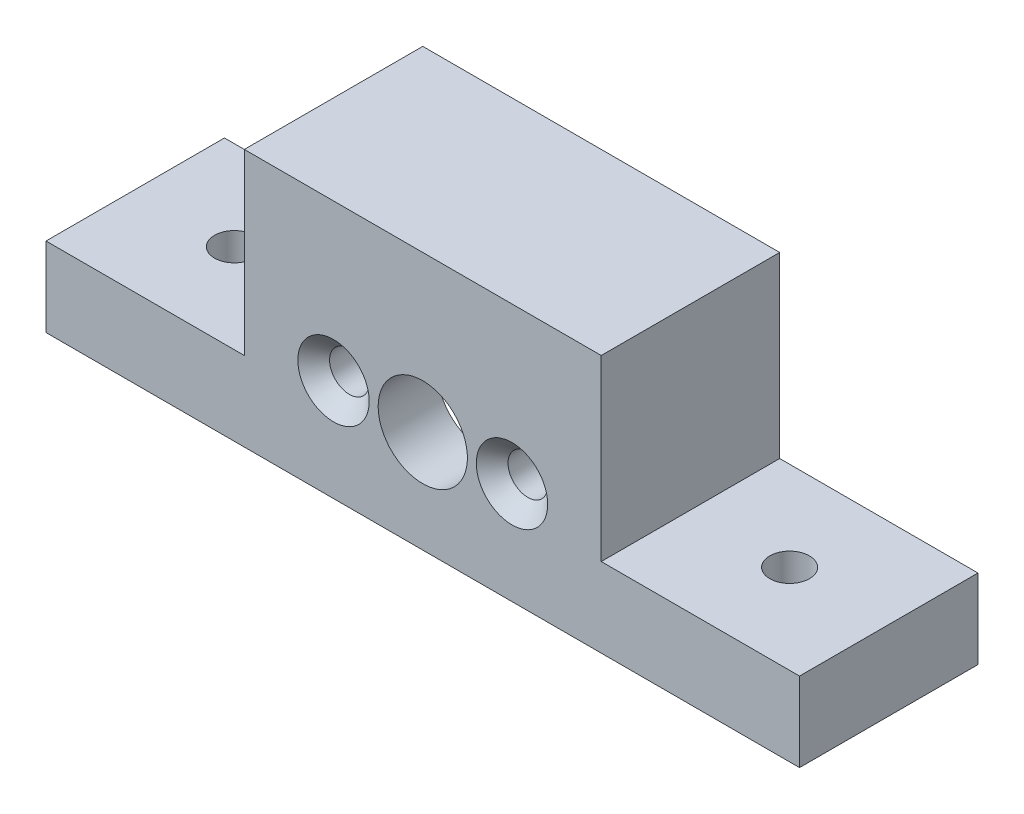
from build123d import *

# Parameters (mm, degrees)
SKETCH3_W                                            = 18
SKETCH3_H                                            = 13
BOSS_EXTRUDE1_DEPTH                                  = 9
SKETCH9_W                                            = 12.6
SKETCH9_H                                            = 10.3
CUT_EXTRUDE2_DEPTH                                   = 6
SKETCH10_R                                           = 2.25
CUT_EXTRUDE3_DEPTH                                   = 13.619429464
CSK_FOR_M1_6_COUNTERSUNK_FLAT_HEAD_SCREW_D           = 2
CSK_FOR_M1_6_COUNTERSUNK_FLAT_HEAD_SCREW_CSINK_D     = 3.6
CSK_FOR_M1_6_COUNTERSUNK_FLAT_HEAD_SCREW_CSINK_ANGLE = 90
SKETCH14_W                                           = 9
SKETCH14_H                                           = 4
BOSS_EXTRUDE2_DEPTH                                  = 10
M1_6_CLEARANCE_HOLE1_D                               = 2


with BuildPart() as part:
    # Sketch3 → Boss-Extrude1 (new body)
    with BuildSketch(Plane.XY):
        Rectangle(SKETCH3_W, SKETCH3_H)
    extrude(amount=BOSS_EXTRUDE1_DEPTH)

    # Sketch9 → Cut-Extrude2 (cut)
    with BuildSketch(Plane(origin=(0, 0, 0), x_dir=(-1, 0, 0), z_dir=(0, 0, -1))):
        with Locations((0, -1.35)):
            Rectangle(SKETCH9_W, SKETCH9_H)
    extrude(amount=-CUT_EXTRUDE2_DEPTH, mode=Mode.SUBTRACT)

    # Sketch10 → Cut-Extrude3 (cut, through all)
    with BuildSketch(Plane(origin=(0, 0, 6), x_dir=(-1, 0, 0), z_dir=(0, 0, -1))):
        with Locations((0, -1.35)):
            Circle(SKETCH10_R)
    extrude(amount=-CUT_EXTRUDE3_DEPTH, mode=Mode.SUBTRACT)

    # CSK for M1.6 Countersunk Flat Head Screw2 (through all)
    with Locations(Plane.XY.offset(9)):
        with Locations((-4.5, -1.35), (4.5, -1.35)):
            CounterSinkHole(CSK_FOR_M1_6_COUNTERSUNK_FLAT_HEAD_SCREW_D / 2, CSK_FOR_M1_6_COUNTERSUNK_FLAT_HEAD_SCREW_CSINK_D / 2, counter_sink_angle=CSK_FOR_M1_6_COUNTERSUNK_FLAT_HEAD_SCREW_CSINK_ANGLE)

    # Sketch14 → Boss-Extrude2 (add)
    with BuildSketch(Plane(origin=(9, 0, 0), x_dir=(0, 0, -1), z_dir=(1, 0, 0))):
        with Locations((-4.5, -4.5)):
            Rectangle(SKETCH14_W, SKETCH14_H)
    boss_extrude2 = extrude(amount=BOSS_EXTRUDE2_DEPTH)

    # M1.6 Clearance Hole1 (through all)
    with Locations(Plane(origin=(0, -2.5, 0), x_dir=(1, 0, 0), z_dir=(0, 1, 0))):
        with Locations((14, -4.5)):
            m1_6_clearance_hole1 = Hole(M1_6_CLEARANCE_HOLE1_D / 2)

    # Mirror2: Boss-Extrude2, M1.6 Clearance Hole1 across plane
    add(boss_extrude2.mirror(Plane(origin=(0, 0, 0), x_dir=(0, 0, 1), z_dir=(1, 0, 0))))
    add(m1_6_clearance_hole1.mirror(Plane(origin=(0, 0, 0), x_dir=(0, 0, 1), z_dir=(1, 0, 0))), mode=Mode.SUBTRACT)


solid = part.part
